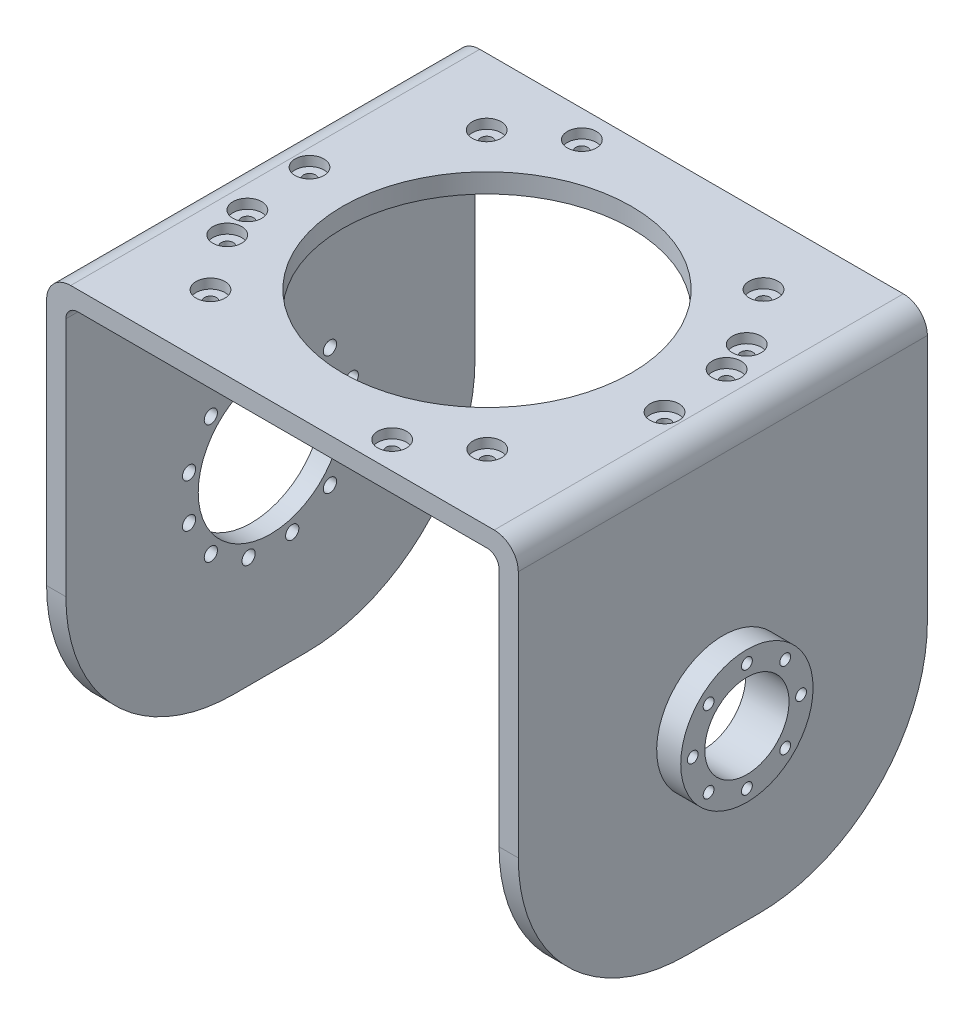
from build123d import *

# Parameters (mm, degrees)
EXTRUDE_1_DEPTH          = 170
SKETCH_2_R               = 60
CUT_EXTRUDE_1_DEPTH      = 180
CUT_EXTRUDE_2_DEPTH      = 313.955268369
CUT_EXTRUDE_2_DEPTH_BACK = 313.955268369
SKETCH_3_R               = 17.5
FILLET_1_R               = 70
FILLET_2_R               = 5
FILLET_3_R               = 10
SKETCH_6_R               = 30
CUT_EXTRUDE_6_DEPTH      = 39
SKETCH_10_R              = 2.5
CUT_EXTRUDE_10_DEPTH     = 10
CUT_EXTRUDE_START        = -4
SKETCH_11_R              = 6
SKETCH_11_R_2            = 2.5
CUT_EXTRUDE_11_DEPTH     = 4
SKETCH_12_R              = 2.75
CUT_EXTRUDE_12_DEPTH     = 10
EXTRUDE_START            = 10
SKETCH_14_R              = 27.5
SKETCH_14_R_2            = 17.5
EXTRUDE_2_DEPTH          = 10
SKETCH_13_R              = 2.25
CUT_EXTRUDE_13_DEPTH     = 15


with BuildPart() as part:
    # 草图1 → 凸台-拉伸1 (new body)
    with BuildSketch(Plane.XY):
        Polygon((-180, 0), (0, 0), (0, -175), (8, -175), (8, 8), (-180, 8), (-188, 8), (-188, -175), (-180, -175), align=None)
    extrude(amount=EXTRUDE_1_DEPTH)

    # 草图2 → 切除-拉伸1 (cut)
    with BuildSketch(Plane(origin=(0, 8, 0), x_dir=(1, 0, 0), z_dir=(0, 1, 0))):
        with Locations(Location((-90, -85, 0), (0, 0, 180))):
            Circle(SKETCH_2_R)
    extrude(amount=-CUT_EXTRUDE_1_DEPTH, mode=Mode.SUBTRACT)

    # 草图3 → 切除-拉伸2 (cut, two sides: drawn at the far end of the back side and taken through both)
    with BuildSketch(Plane(origin=(8, 0, 0), x_dir=(0, 0, -1), z_dir=(1, 0, 0)).offset(-CUT_EXTRUDE_2_DEPTH_BACK)):
        with Locations(Location((-85, -95, 0), (0, 0, 90))):
            Circle(SKETCH_3_R)
    extrude(amount=CUT_EXTRUDE_2_DEPTH + CUT_EXTRUDE_2_DEPTH_BACK, mode=Mode.SUBTRACT)

    # 圆角1
    fillet_1_edges = [part.edges().sort_by_distance(p)[0] for p in [
        (4, -175, 0),
        (4, -175, 170),
        (-184, -175, 170),
        (-184, -175, 0),
    ]]
    fillet(fillet_1_edges, radius=FILLET_1_R)

    # 圆角2
    fillet_2_edges = [part.edges().sort_by_distance(p)[0] for p in [
        (0, 0, 85),
        (-180, 0, 85),
    ]]
    fillet(fillet_2_edges, radius=FILLET_2_R)

    # 圆角3
    fillet_3_edges = [part.edges().sort_by_distance(p)[0] for p in [
        (-188, 8, 85),
        (8, 8, 85),
    ]]
    fillet(fillet_3_edges, radius=FILLET_3_R)

    # 草图6 → 切除-拉伸6 (cut)
    with BuildSketch(Plane.ZY.offset(188)):
        with Locations(Location((85, -95, 0), (0, 0, 270))):
            Circle(SKETCH_6_R)
    extrude(amount=-CUT_EXTRUDE_6_DEPTH, mode=Mode.SUBTRACT)

    # 草图10 → 切除-拉伸10 (cut)
    with BuildSketch(Plane.XZ):
        with Locations(Location((-55.742253069, 158.674753309, 0), (0, 0, 270))):
            Circle(SKETCH_10_R)
        with Locations(Location((-32.485217492, 142.390001682, 0), (0, 0, 270))):
            Circle(SKETCH_10_R)
        with Locations(Location((-9.066918551, 92.169297536, 0), (0, 0, 270))):
            Circle(SKETCH_10_R)
        with Locations(Location((-11.541409366, 63.885738097, 0), (0, 0, 270))):
            Circle(SKETCH_10_R)
        with Locations(Location((-16.325246691, 50.742253069, 0), (0, 0, 270))):
            Circle(SKETCH_10_R)
        with Locations(Location((-32.609998318, 27.485217492, 0), (0, 0, 270))):
            Circle(SKETCH_10_R)
        with Locations(Location((-124.257746931, 11.325246691, 0), (0, 0, 270))):
            Circle(SKETCH_10_R)
        with Locations(Location((-147.514782508, 27.609998318, 0), (0, 0, 270))):
            Circle(SKETCH_10_R)
        with Locations(Location((-170.933081449, 77.830702464, 0), (0, 0, 270))):
            Circle(SKETCH_10_R)
        with Locations(Location((-168.458590634, 106.114261903, 0), (0, 0, 270))):
            Circle(SKETCH_10_R)
        with Locations(Location((-163.674753309, 119.257746931, 0), (0, 0, 270))):
            Circle(SKETCH_10_R)
        with Locations(Location((-147.390001682, 142.514782508, 0), (0, 0, 270))):
            Circle(SKETCH_10_R)
    extrude(amount=-CUT_EXTRUDE_10_DEPTH, mode=Mode.SUBTRACT)

    # 草图11 → 切除-拉伸11 (cut)
    # profile 1 of 12: a face of its own
    with BuildSketch(Plane(origin=(0, 8, 0), x_dir=(1, 0, 0), z_dir=(0, 1, 0)).offset(CUT_EXTRUDE_START)):
        with Locations(Location((-32.485217492, -142.390001682, 0), (0, 0, 180))):
            Circle(SKETCH_11_R)
        with Locations(Location((-32.485217492, -142.390001682, 0), (0, 0, 90))):
            Circle(SKETCH_11_R_2, mode=Mode.SUBTRACT)
    # profile 2 of 12: a face of its own
    with BuildSketch(Plane(origin=(0, 8, 0), x_dir=(1, 0, 0), z_dir=(0, 1, 0)).offset(CUT_EXTRUDE_START)):
        with Locations(Location((-55.742253069, -158.674753309, 0), (0, 0, 180))):
            Circle(SKETCH_11_R)
        with Locations(Location((-55.742253069, -158.674753309, 0), (0, 0, 90))):
            Circle(SKETCH_11_R_2, mode=Mode.SUBTRACT)
    # profile 3 of 12: a face of its own
    with BuildSketch(Plane(origin=(0, 8, 0), x_dir=(1, 0, 0), z_dir=(0, 1, 0)).offset(CUT_EXTRUDE_START)):
        with Locations(Location((-147.390001682, -142.514782508, 0), (0, 0, 180))):
            Circle(SKETCH_11_R)
        with Locations(Location((-147.390001682, -142.514782508, 0), (0, 0, 90))):
            Circle(SKETCH_11_R_2, mode=Mode.SUBTRACT)
    # profile 4 of 12: a face of its own
    with BuildSketch(Plane(origin=(0, 8, 0), x_dir=(1, 0, 0), z_dir=(0, 1, 0)).offset(CUT_EXTRUDE_START)):
        with Locations(Location((-163.674753309, -119.257746931, 0), (0, 0, 180))):
            Circle(SKETCH_11_R)
        with Locations(Location((-163.674753309, -119.257746931, 0), (0, 0, 90))):
            Circle(SKETCH_11_R_2, mode=Mode.SUBTRACT)
    # profile 5 of 12: a face of its own
    with BuildSketch(Plane(origin=(0, 8, 0), x_dir=(1, 0, 0), z_dir=(0, 1, 0)).offset(CUT_EXTRUDE_START)):
        with Locations(Location((-168.458590634, -106.114261903, 0), (0, 0, 180))):
            Circle(SKETCH_11_R)
        with Locations(Location((-168.458590634, -106.114261903, 0), (0, 0, 90))):
            Circle(SKETCH_11_R_2, mode=Mode.SUBTRACT)
    # profile 6 of 12: a face of its own
    with BuildSketch(Plane(origin=(0, 8, 0), x_dir=(1, 0, 0), z_dir=(0, 1, 0)).offset(CUT_EXTRUDE_START)):
        with Locations(Location((-170.933081449, -77.830702464, 0), (0, 0, 180))):
            Circle(SKETCH_11_R)
        with Locations(Location((-170.933081449, -77.830702464, 0), (0, 0, 90))):
            Circle(SKETCH_11_R_2, mode=Mode.SUBTRACT)
    # profile 7 of 12: a face of its own
    with BuildSketch(Plane(origin=(0, 8, 0), x_dir=(1, 0, 0), z_dir=(0, 1, 0)).offset(CUT_EXTRUDE_START)):
        with Locations(Location((-147.514782508, -27.609998318, 0), (0, 0, 180))):
            Circle(SKETCH_11_R)
        with Locations(Location((-147.514782508, -27.609998318, 0), (0, 0, 90))):
            Circle(SKETCH_11_R_2, mode=Mode.SUBTRACT)
    # profile 8 of 12: a face of its own
    with BuildSketch(Plane(origin=(0, 8, 0), x_dir=(1, 0, 0), z_dir=(0, 1, 0)).offset(CUT_EXTRUDE_START)):
        with Locations(Location((-124.257746931, -11.325246691, 0), (0, 0, 180))):
            Circle(SKETCH_11_R)
        with Locations(Location((-124.257746931, -11.325246691, 0), (0, 0, 90))):
            Circle(SKETCH_11_R_2, mode=Mode.SUBTRACT)
    # profile 9 of 12: a face of its own
    with BuildSketch(Plane(origin=(0, 8, 0), x_dir=(1, 0, 0), z_dir=(0, 1, 0)).offset(CUT_EXTRUDE_START)):
        with Locations(Location((-32.609998318, -27.485217492, 0), (0, 0, 180))):
            Circle(SKETCH_11_R)
        with Locations(Location((-32.609998318, -27.485217492, 0), (0, 0, 90))):
            Circle(SKETCH_11_R_2, mode=Mode.SUBTRACT)
    # profile 10 of 12: a face of its own
    with BuildSketch(Plane(origin=(0, 8, 0), x_dir=(1, 0, 0), z_dir=(0, 1, 0)).offset(CUT_EXTRUDE_START)):
        with Locations(Location((-16.325246691, -50.742253069, 0), (0, 0, 180))):
            Circle(SKETCH_11_R)
        with Locations(Location((-16.325246691, -50.742253069, 0), (0, 0, 90))):
            Circle(SKETCH_11_R_2, mode=Mode.SUBTRACT)
    # profile 11 of 12: a face of its own
    with BuildSketch(Plane(origin=(0, 8, 0), x_dir=(1, 0, 0), z_dir=(0, 1, 0)).offset(CUT_EXTRUDE_START)):
        with Locations(Location((-11.541409366, -63.885738097, 0), (0, 0, 180))):
            Circle(SKETCH_11_R)
        with Locations(Location((-11.541409366, -63.885738097, 0), (0, 0, 90))):
            Circle(SKETCH_11_R_2, mode=Mode.SUBTRACT)
    # profile 12 of 12: a face of its own
    with BuildSketch(Plane(origin=(0, 8, 0), x_dir=(1, 0, 0), z_dir=(0, 1, 0)).offset(CUT_EXTRUDE_START)):
        with Locations(Location((-9.066918551, -92.169297536, 0), (0, 0, 180))):
            Circle(SKETCH_11_R)
        with Locations(Location((-9.066918551, -92.169297536, 0), (0, 0, 90))):
            Circle(SKETCH_11_R_2, mode=Mode.SUBTRACT)
    extrude(amount=CUT_EXTRUDE_11_DEPTH, mode=Mode.SUBTRACT)

    # 草图12 → 切除-拉伸12 (cut)
    with BuildSketch(Plane.ZY.offset(188)):
        with Locations(Location((94.058666579, -128.80740392, 0), (0, 0, 270))):
            Circle(SKETCH_12_R)
        with Locations(Location((75.941333421, -128.80740392, 0), (0, 0, 270))):
            Circle(SKETCH_12_R)
        with Locations(Location((60.251262658, -119.748737342, 0), (0, 0, 270))):
            Circle(SKETCH_12_R)
        with Locations(Location((51.19259608, -104.058666579, 0), (0, 0, 270))):
            Circle(SKETCH_12_R)
        with Locations(Location((51.19259608, -85.941333421, 0), (0, 0, 270))):
            Circle(SKETCH_12_R)
        with Locations(Location((60.251262658, -70.251262658, 0), (0, 0, 270))):
            Circle(SKETCH_12_R)
        with Locations(Location((75.941333421, -61.19259608, 0), (0, 0, 270))):
            Circle(SKETCH_12_R)
        with Locations(Location((94.058666579, -61.19259608, 0), (0, 0, 270))):
            Circle(SKETCH_12_R)
        with Locations(Location((109.748737342, -70.251262658, 0), (0, 0, 270))):
            Circle(SKETCH_12_R)
        with Locations(Location((118.80740392, -85.941333421, 0), (0, 0, 270))):
            Circle(SKETCH_12_R)
        with Locations(Location((118.80740392, -104.058666579, 0), (0, 0, 270))):
            Circle(SKETCH_12_R)
        with Locations(Location((109.748737342, -119.748737342, 0), (0, 0, 270))):
            Circle(SKETCH_12_R)
    extrude(amount=-CUT_EXTRUDE_12_DEPTH, mode=Mode.SUBTRACT)

    # 草图14 → 凸台-拉伸2 (add)
    with BuildSketch(Plane(origin=(8, 0, 0), x_dir=(0, 0, -1), z_dir=(1, 0, 0)).offset(EXTRUDE_START)):
        with Locations(Location((-85, -95, 0), (0, 0, 270))):
            Circle(SKETCH_14_R)
        with Locations(Location((-85, -95, 0), (0, 0, 90))):
            Circle(SKETCH_14_R_2, mode=Mode.SUBTRACT)
    extrude(amount=-EXTRUDE_2_DEPTH)

    # 草图13 → 切除-拉伸13 (cut, symmetric)
    with BuildSketch(Plane(origin=(8, 0, 0), x_dir=(0, 0, -1), z_dir=(1, 0, 0))):
        with Locations(Location((-85, -72.5, 0), (0, 0, 90))):
            Circle(SKETCH_13_R)
        with Locations(Location((-69.090097423, -79.090097423, 0), (0, 0, 90))):
            Circle(SKETCH_13_R)
        with Locations(Location((-62.5, -95, 0), (0, 0, 90))):
            Circle(SKETCH_13_R)
        with Locations(Location((-69.090097423, -110.909902577, 0), (0, 0, 90))):
            Circle(SKETCH_13_R)
        with Locations(Location((-85, -117.5, 0), (0, 0, 90))):
            Circle(SKETCH_13_R)
        with Locations(Location((-100.909902577, -110.909902577, 0), (0, 0, 90))):
            Circle(SKETCH_13_R)
        with Locations(Location((-107.5, -95, 0), (0, 0, 90))):
            Circle(SKETCH_13_R)
        with Locations(Location((-100.909902577, -79.090097423, 0), (0, 0, 90))):
            Circle(SKETCH_13_R)
    extrude(amount=CUT_EXTRUDE_13_DEPTH, both=True, mode=Mode.SUBTRACT)


solid = part.part
